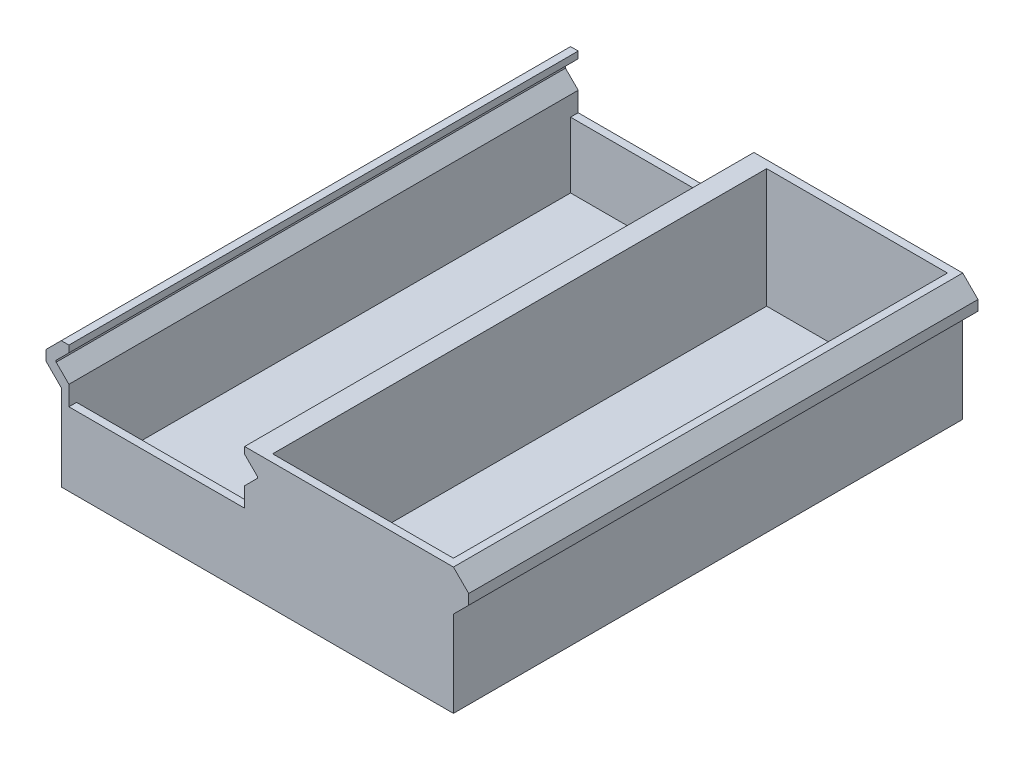
from build123d import *

# Parameters (mm, degrees)
EXTRUDE_1_DEPTH     = 200
SKETCH_2_W          = 148
SKETCH_2_H          = 194
CUT_EXTRUDE_1_DEPTH = 46.779006664
SKETCH_3_W          = 8
SKETCH_3_H          = 194
EXTRUDE_1_2_DEPTH   = 46.779006664
CUT_EXTRUDE_2_DEPTH = 223.186744664


with BuildPart() as part:
    # 草图1 → Extrude 1 (new body)
    with BuildSketch(Plane.XY):
        Polygon((77, 0), (-77, 0), (-77, 33.779006664), (-83, 39.779006664), (-83, 43.779006664), (-77, 49.779006664), (77, 49.779006664), (83, 43.779006664), (83, 39.779006664), (77, 33.779006664), align=None)
    extrude(amount=-EXTRUDE_1_DEPTH)

    # 草图2 → 切除-拉伸1 (cut)
    with BuildSketch(Plane(origin=(0, 49.779006664, 0), x_dir=(1, 0, 0), z_dir=(0, 1, 0))):
        with Locations((0, 100)):
            Rectangle(SKETCH_2_W, SKETCH_2_H)
    extrude(amount=-CUT_EXTRUDE_1_DEPTH, mode=Mode.SUBTRACT)

    # 草图3 → Extrude 1 2 (add)
    with BuildSketch(Plane(origin=(0, 3, 0), x_dir=(1, 0, 0), z_dir=(0, 1, 0))):
        with Locations((-1, 100)):
            Rectangle(SKETCH_3_W, SKETCH_3_H)
    extrude(amount=EXTRUDE_1_2_DEPTH)

    # 草图4 → 切除-拉伸2 (cut, through all)
    with BuildSketch(Plane.XY):
        Polygon((-74, 49.779006664), (-74, 47.122152414), (-79, 42.122152414), (-79, 41.435860913), (-74, 36.435860913), (-74, 28.779006664), (-5, 28.779006664), (-5, 36.435860913), (0, 41.435860913), (0, 42.122152414), (-5, 47.122152414), (-5, 49.779006664), align=None)
    extrude(amount=-CUT_EXTRUDE_2_DEPTH, mode=Mode.SUBTRACT)


solid = part.part
